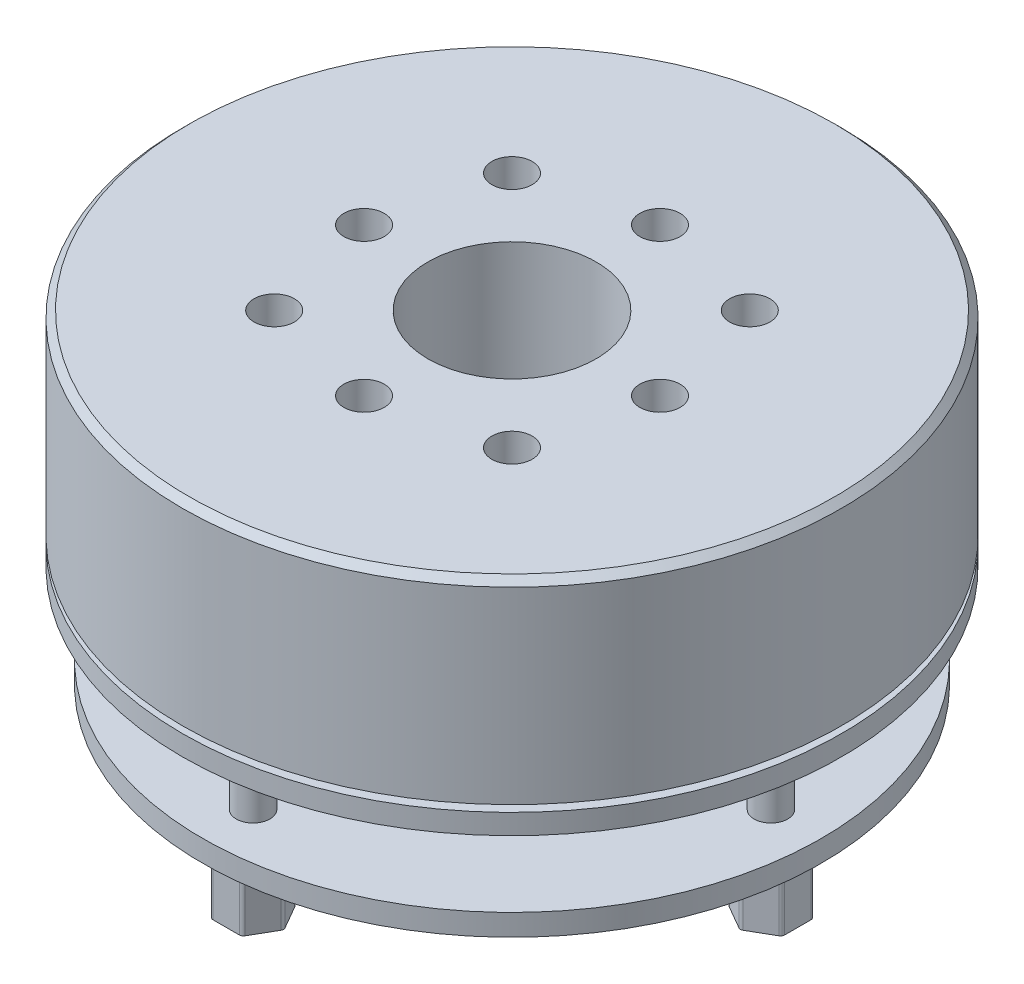
from build123d import *

# Parameters (mm, degrees)
SKETCH_2_R          = 1.5
CUT_EXTRUDE_1_DEPTH = 3
SKETCH_3_R          = 6.25
CUT_EXTRUDE_2_DEPTH = 18
SKETCH_6_R          = 1.25
EXTRUDE_1_DEPTH     = 4.5
SKETCH_7_R          = 23
EXTRUDE_2_DEPTH     = 1.6
SKETCH_10_R         = 1.25
EXTRUDE_3_DEPTH     = 5
EXTRUDE_3_2_DEPTH   = 5
EXTRUDE_3_3_DEPTH   = 5
EXTRUDE_3_4_DEPTH   = 5


with BuildPart() as part:
    # 草图1 → 旋转1 (revolve)
    with BuildSketch(Plane.XY, mode=Mode.PRIVATE) as revolve_1_sk:
        Polygon((24, 22.1), (0, 22.1), (0, 4.545296676), (0, 3.1), (8.3, 3.1), (8.3, 4.1), (22, 4.1), (22, 5.6), (24.5, 5.6), (24.5, 7.1), (23.5, 7.1), (23.5, 7.6), (24.5, 7.6), (24.5, 21.6), align=None)
    revolve(revolve_1_sk.sketch.rotate(Axis((0, 4.545296676, 0), (0, 1, 0)), 90), axis=Axis((0, 4.545296676, 0), (0, 1, 0)))

    # 草图2 → 切除-拉伸1 (cut)
    with BuildSketch(Plane(origin=(0, 22.1, 0), x_dir=(1, 0, 0), z_dir=(0, 1, 0))):
        with Locations(Location((0, 11, 0), (0, 0, 270))):
            Circle(SKETCH_2_R)
        with Locations(Location((11, 0, 0), (0, 0, 270))):
            Circle(SKETCH_2_R)
        with Locations(Location((0, -11, 0), (0, 0, 270))):
            Circle(SKETCH_2_R)
        with Locations(Location((-11, 0, 0), (0, 0, 270))):
            Circle(SKETCH_2_R)
        with Locations(Location((8.838834765, 8.838834765, 0), (0, 0, 270))):
            Circle(SKETCH_2_R)
        with Locations(Location((8.838834765, -8.838834765, 0), (0, 0, 270))):
            Circle(SKETCH_2_R)
        with Locations(Location((-8.838834765, -8.838834765, 0), (0, 0, 270))):
            Circle(SKETCH_2_R)
        with Locations(Location((-8.838834765, 8.838834765, 0), (0, 0, 270))):
            Circle(SKETCH_2_R)
    extrude(amount=-CUT_EXTRUDE_1_DEPTH, mode=Mode.SUBTRACT)

    # 草图3 → 切除-拉伸2 (cut)
    with BuildSketch(Plane(origin=(0, 22.1, 0), x_dir=(1, 0, 0), z_dir=(0, 1, 0))):
        with Locations(Location((0, 0, 0), (0, 0, 270))):
            Circle(SKETCH_3_R)
    extrude(amount=-CUT_EXTRUDE_2_DEPTH, mode=Mode.SUBTRACT)

    # 草图6 → 凸台-拉伸1 (add)
    with BuildSketch(Plane.XZ.offset(-4.1)):
        with Locations(Location((0, 19.25, 0), (0, 0, 270))):
            Circle(SKETCH_6_R)
        with Locations(Location((19.25, 0, 0), (0, 0, 270))):
            Circle(SKETCH_6_R)
        with Locations(Location((0, -19.25, 0), (0, 0, 270))):
            Circle(SKETCH_6_R)
        with Locations(Location((-19.25, 0, 0), (0, 0, 270))):
            Circle(SKETCH_6_R)
    extrude(amount=EXTRUDE_1_DEPTH)

    # 草图7 → 凸台-拉伸2 (add)
    with BuildSketch(Plane.XZ.offset(0.4)):
        with Locations(Location((0, 0, 0), (0, 0, 270))):
            Circle(SKETCH_7_R)
    extrude(amount=EXTRUDE_2_DEPTH)


with BuildPart() as body_2:
    # 草图10 → 凸台-拉伸3 (new body)
    with BuildSketch(Plane.XZ.offset(2)):
        with BuildLine():
            Line((21.1, 1.241303079), (19.4, 2.222798536))
            ThreePointArc((19.4, 2.222798536), (19.25, 2.262990915), (19.1, 2.222798536))
            Line((19.1, 2.222798536), (17.4, 1.241303079))
            ThreePointArc((17.4, 1.241303079), (17.290192379, 1.131495458), (17.25, 0.981495458))
            Line((17.25, 0.981495458), (17.25, -0.981495458))
            ThreePointArc((17.25, -0.981495458), (17.290192379, -1.131495458), (17.4, -1.241303079))
            Line((17.4, -1.241303079), (19.1, -2.222798536))
            ThreePointArc((19.1, -2.222798536), (19.25, -2.262990915), (19.4, -2.222798536))
            Line((19.4, -2.222798536), (21.1, -1.241303079))
            ThreePointArc((21.1, -1.241303079), (21.209807621, -1.131495458), (21.25, -0.981495458))
            Line((21.25, -0.981495458), (21.25, 0.981495458))
            ThreePointArc((21.25, 0.981495458), (21.209807621, 1.131495458), (21.1, 1.241303079))
        make_face()
        with Locations(Location((19.25, 0, 0), (0, 0, 270))):
            Circle(SKETCH_10_R, mode=Mode.SUBTRACT)
    extrude(amount=EXTRUDE_3_DEPTH)


with BuildPart() as body_3:
    # 草图10 → Extrude 3 2 (new body)
    with BuildSketch(Plane.XZ.offset(2)):
        with BuildLine():
            Line((-1.241303079, 21.1), (-2.222798536, 19.4))
            ThreePointArc((-2.222798536, 19.4), (-2.262990915, 19.25), (-2.222798536, 19.1))
            Line((-2.222798536, 19.1), (-1.241303079, 17.4))
            ThreePointArc((-1.241303079, 17.4), (-1.131495458, 17.290192379), (-0.981495458, 17.25))
            Line((-0.981495458, 17.25), (0.981495458, 17.25))
            ThreePointArc((0.981495458, 17.25), (1.131495458, 17.290192379), (1.241303079, 17.4))
            Line((1.241303079, 17.4), (2.222798536, 19.1))
            ThreePointArc((2.222798536, 19.1), (2.262990915, 19.25), (2.222798536, 19.4))
            Line((2.222798536, 19.4), (1.241303079, 21.1))
            ThreePointArc((1.241303079, 21.1), (1.131495458, 21.209807621), (0.981495458, 21.25))
            Line((0.981495458, 21.25), (-0.981495458, 21.25))
            ThreePointArc((-0.981495458, 21.25), (-1.131495458, 21.209807621), (-1.241303079, 21.1))
        make_face()
        with Locations(Location((0, 19.25, 0), (0, 0, 270))):
            Circle(SKETCH_10_R, mode=Mode.SUBTRACT)
    extrude(amount=EXTRUDE_3_2_DEPTH)


with BuildPart() as body_4:
    # 草图10 → Extrude 3 3 (new body)
    with BuildSketch(Plane.XZ.offset(2)):
        with BuildLine():
            Line((1.241303079, -21.1), (2.222798536, -19.4))
            ThreePointArc((2.222798536, -19.4), (2.262990915, -19.25), (2.222798536, -19.1))
            Line((2.222798536, -19.1), (1.241303079, -17.4))
            ThreePointArc((1.241303079, -17.4), (1.131495458, -17.290192379), (0.981495458, -17.25))
            Line((0.981495458, -17.25), (-0.981495458, -17.25))
            ThreePointArc((-0.981495458, -17.25), (-1.131495458, -17.290192379), (-1.241303079, -17.4))
            Line((-1.241303079, -17.4), (-2.222798536, -19.1))
            ThreePointArc((-2.222798536, -19.1), (-2.262990915, -19.25), (-2.222798536, -19.4))
            Line((-2.222798536, -19.4), (-1.241303079, -21.1))
            ThreePointArc((-1.241303079, -21.1), (-1.131495458, -21.209807621), (-0.981495458, -21.25))
            Line((-0.981495458, -21.25), (0.981495458, -21.25))
            ThreePointArc((0.981495458, -21.25), (1.131495458, -21.209807621), (1.241303079, -21.1))
        make_face()
        with Locations(Location((0, -19.25, 0), (0, 0, 270))):
            Circle(SKETCH_10_R, mode=Mode.SUBTRACT)
    extrude(amount=EXTRUDE_3_3_DEPTH)


with BuildPart() as body_5:
    # 草图10 → Extrude 3 4 (new body)
    with BuildSketch(Plane.XZ.offset(2)):
        with BuildLine():
            Line((-21.1, -1.241303079), (-19.4, -2.222798536))
            ThreePointArc((-19.4, -2.222798536), (-19.25, -2.262990915), (-19.1, -2.222798536))
            Line((-19.1, -2.222798536), (-17.4, -1.241303079))
            ThreePointArc((-17.4, -1.241303079), (-17.290192379, -1.131495458), (-17.25, -0.981495458))
            Line((-17.25, -0.981495458), (-17.25, 0.981495458))
            ThreePointArc((-17.25, 0.981495458), (-17.290192379, 1.131495458), (-17.4, 1.241303079))
            Line((-17.4, 1.241303079), (-19.1, 2.222798536))
            ThreePointArc((-19.1, 2.222798536), (-19.25, 2.262990915), (-19.4, 2.222798536))
            Line((-19.4, 2.222798536), (-21.1, 1.241303079))
            ThreePointArc((-21.1, 1.241303079), (-21.209807621, 1.131495458), (-21.25, 0.981495458))
            Line((-21.25, 0.981495458), (-21.25, -0.981495458))
            ThreePointArc((-21.25, -0.981495458), (-21.209807621, -1.131495458), (-21.1, -1.241303079))
        make_face()
        with Locations(Location((-19.25, 0, 0), (0, 0, 270))):
            Circle(SKETCH_10_R, mode=Mode.SUBTRACT)
    extrude(amount=EXTRUDE_3_4_DEPTH)


solid = Compound([part.part, body_2.part, body_3.part, body_4.part, body_5.part])
